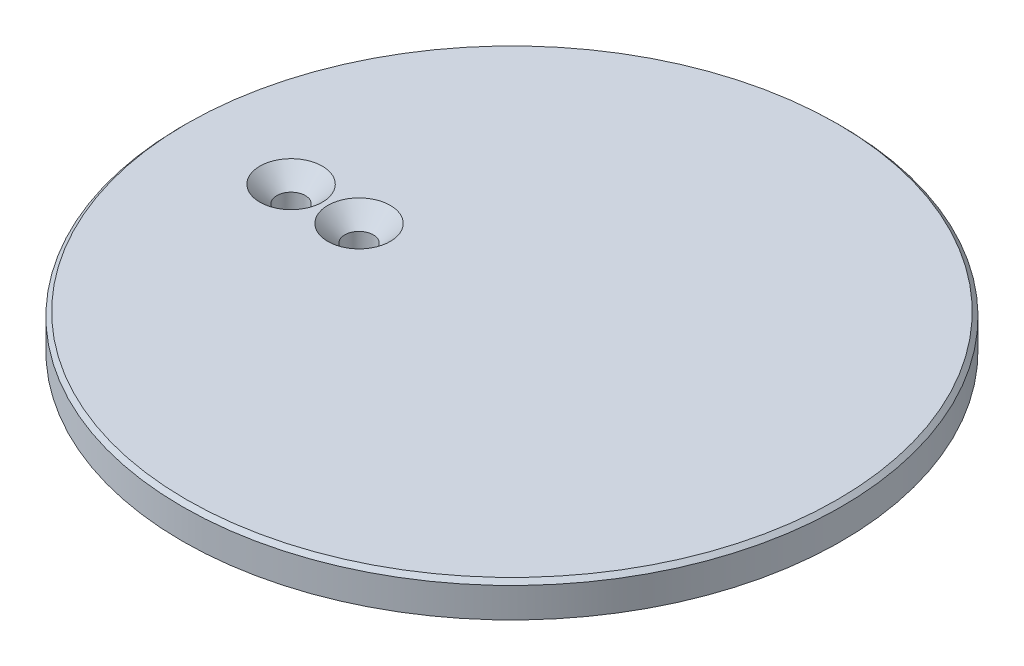
from build123d import *

# Parameters (mm, degrees)
SKIZZE1_R                       = 48.5
AUFSATZ_LINEAR_AUSTRAGEN1_DEPTH = 5
SKIZZE2_W                       = 20
SKIZZE2_H                       = 13
AUFSATZ_LINEAR_AUSTRAGEN2_DEPTH = 20
SKIZZE3_W                       = 20
SKIZZE3_H                       = 2
AUFSATZ_LINEAR_AUSTRAGEN3_DEPTH = 23
SKIZZE4_R                       = 2.1
SCHNITT_LINEAR_AUSTRAGEN1_DEPTH = 74.003424577
FASE4_SIZE                      = 0.6
FASE6_SIZE                      = 2.5


with BuildPart() as part:
    # Skizze1 → Aufsatz-Linear austragen1 (new body)
    with BuildSketch(Plane(origin=(0, 0, 0), x_dir=(1, 0, 0), z_dir=(0, 1, 0))):
        with Locations(Location((0, 0, 0), (0, 0, 270))):
            Circle(SKIZZE1_R)
    extrude(amount=AUFSATZ_LINEAR_AUSTRAGEN1_DEPTH)

    # Skizze2 → Aufsatz-Linear austragen2 (add)
    with BuildSketch(Plane.XZ):
        with Locations((-27.5, 0)):
            Rectangle(SKIZZE2_W, SKIZZE2_H)
    extrude(amount=AUFSATZ_LINEAR_AUSTRAGEN2_DEPTH)

    # Skizze3 → Aufsatz-Linear austragen3 (add)
    with BuildSketch(Plane.XZ):
        with Locations((-27.5, 7.5)):
            Rectangle(SKIZZE3_W, SKIZZE3_H)
        with Locations((-27.5, -7.5)):
            Rectangle(SKIZZE3_W, SKIZZE3_H)
    extrude(amount=AUFSATZ_LINEAR_AUSTRAGEN3_DEPTH)

    # Skizze4 → Schnitt-Linear austragen1 (cut, through all)
    with BuildSketch(Plane.XZ.offset(20)):
        with Locations(Location((-32.5, 0, 0), (0, 0, 270))):
            Circle(SKIZZE4_R)
        with Locations(Location((-22.5, 0, 0), (0, 0, 270))):
            Circle(SKIZZE4_R)
    extrude(amount=-SCHNITT_LINEAR_AUSTRAGEN1_DEPTH, mode=Mode.SUBTRACT)

    # Fase4
    fase4_edges = [part.edges().sort_by_distance(p)[0] for p in [
        (0, 5, -48.5),
    ]]
    chamfer(fase4_edges, length=FASE4_SIZE)

    # Fase6
    fase6_edges = [part.edges().sort_by_distance(p)[0] for p in [
        (-32.5, 5, 2.1),
        (-22.5, 5, 2.1),
    ]]
    chamfer(fase6_edges, length=FASE6_SIZE)


solid = part.part
